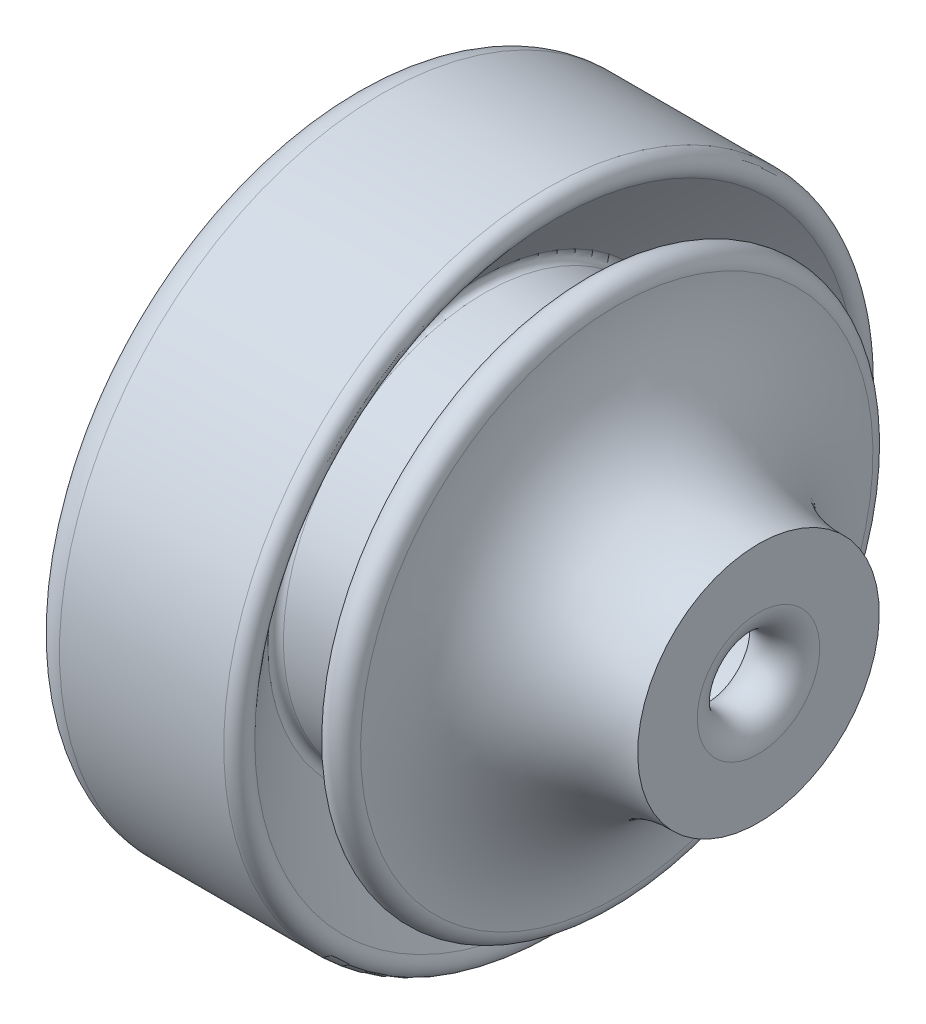
from build123d import *


with BuildPart() as part:
    # ｽｹｯﾁ1 → 回転1 (revolve)
    with BuildSketch(Plane.XY):
        with BuildLine():
            Line((-5.3, 9), (-5.3, 1.65))
            ThreePointArc((-5.3, 1.65), (-4.945117855, 1.252552671), (-4.510178104, 1.560340145))
            Line((-4.510178104, 1.560340145), (-4.3, 2.474149638))
            ThreePointArc((-4.3, 2.474149638), (-3.937249649, 3.041009097), (-3.297402407, 3.249606722))
            Line((-3.297402407, 3.249606722), (5.6, 3))
            Line((5.6, 3), (5.6, 1.9))
            ThreePointArc((5.6, 1.9), (6.5, 1), (7.4, 1.9))
            Line((7.4, 1.9), (7.4, 3.75))
            ThreePointArc((7.4, 3.75), (4.301185279, 4.910830075), (3, 7.953377693))
            ThreePointArc((3, 7.953377693), (2.5, 8.453377693), (2, 7.953377693))
            Line((2, 7.953377693), (2, 6.25))
            Line((2, 6.25), (-1.1, 6.25))
            ThreePointArc((-1.1, 6.25), (-1.257471318, 6.326700429), (-1.294161459, 6.497972159))
            Line((-1.294161459, 6.497972159), (-0.428903044, 10))
            Line((-0.428903044, 10), (-4.3, 10))
            ThreePointArc((-4.3, 10), (-5.007106781, 9.707106781), (-5.3, 9))
        make_face()
    revolve(axis=Axis((0, 0, 0), (-1, 0, 0)))

    # ｽｹｯﾁ1<4> → 回転3 (revolve)
    with BuildSketch(Plane.XY):
        with BuildLine():
            Line((0.8, 10), (-0.428903044, 10))
            Line((-0.428903044, 10), (-1.294161459, 6.497972159))
            ThreePointArc((-1.294161459, 6.497972159), (-1.277913027, 6.541361671), (-1.252116619, 6.57984812))
            Line((-1.252116619, 6.57984812), (1.104233238, 9.340303761))
            ThreePointArc((1.104233238, 9.340303761), (1.163234425, 9.767513439), (0.8, 10))
        make_face()
    revolve(axis=Axis((0, 0, 0), (-1, 0, 0)))


solid = part.part
